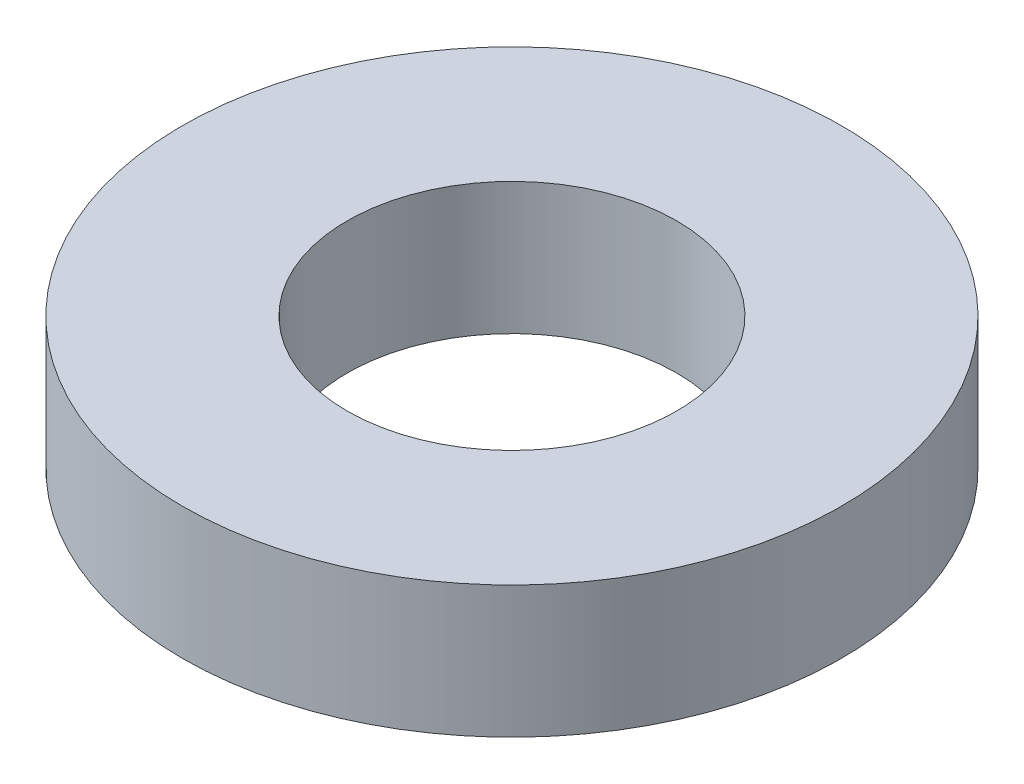
from build123d import *

# Parameters (mm, degrees)
SKETCH1_R           = 6.35
BOSS_EXTRUDE1_DEPTH = 2.54
SKETCH2_R           = 3.175
CUT_EXTRUDE1_DEPTH  = 2.54


with BuildPart() as part:
    # Sketch1 → Boss-Extrude1 (new body)
    with BuildSketch(Plane(origin=(0, 0, 0), x_dir=(1, 0, 0), z_dir=(0, 1, 0))):
        with Locations(Location((0, 0, 0), (0, 0, 270))):
            Circle(SKETCH1_R)
    extrude(amount=BOSS_EXTRUDE1_DEPTH)

    # Sketch2 → Cut-Extrude1 (cut)
    with BuildSketch(Plane(origin=(0, 2.54, 0), x_dir=(1, 0, 0), z_dir=(0, 1, 0))):
        with Locations(Location((0, 0, 0), (0, 0, 270))):
            Circle(SKETCH2_R)
    extrude(amount=-CUT_EXTRUDE1_DEPTH, mode=Mode.SUBTRACT)


solid = part.part
